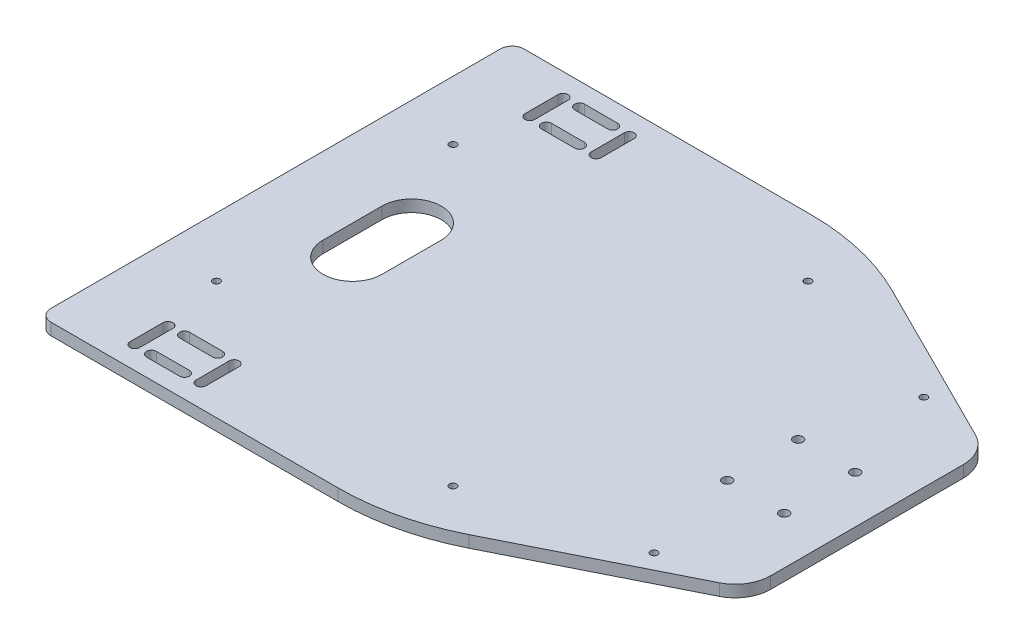
from build123d import *

# Parameters (mm, degrees)
BOSS_EXTRUDE2_DEPTH = 5
SKETCH7_R           = 1.5
CUT_EXTRUDE1_DEPTH  = 5
CUT_EXTRUDE2_DEPTH  = 5
SKETCH14_R          = 1.5
CUT_EXTRUDE3_DEPTH  = 161.15617378
SKETCH16_R          = 2
CUT_EXTRUDE4_DEPTH  = 161.15617378
CUT_EXTRUDE5_DEPTH  = 5


with BuildPart() as part:
    # Sketch1 → Boss-Extrude2 (new body)
    with BuildSketch(Plane(origin=(0, 0, 0), x_dir=(1, 0, 0), z_dir=(0, 1, 0))):
        with BuildLine():
            Line((-120, 100), (1.39320225, 100))
            ThreePointArc((1.39320225, 100), (24.368494305, 97.324898947), (46.1145618, 89.4427191))
            Line((46.1145618, 89.4427191), (116.708203932, 54.145898034))
            ThreePointArc((116.708203932, 54.145898034), (122.759762125, 48.615456851), (125, 40.729490169))
            Line((125, 40.729490169), (125, -40.729490169))
            ThreePointArc((125, -40.729490169), (122.759762125, -48.615456851), (116.708203932, -54.145898034))
            Line((116.708203932, -54.145898034), (46.1145618, -89.4427191))
            ThreePointArc((46.1145618, -89.4427191), (24.368494305, -97.324898947), (1.39320225, -100))
            Line((1.39320225, -100), (-120, -100))
            ThreePointArc((-120, -100), (-123.535533906, -98.535533906), (-125, -95))
            Line((-125, -95), (-125, 95))
            ThreePointArc((-125, 95), (-123.535533906, 98.535533906), (-120, 100))
        make_face()
    extrude(amount=-BOSS_EXTRUDE2_DEPTH)

    # Sketch7 → Cut-Extrude1 (cut)
    with BuildSketch(Plane(origin=(0, 0, 0), x_dir=(1, 0, 0), z_dir=(0, 1, 0))):
        with Locations(Location((-100, 50.003580751, 0), (0, 0, 270))):
            Circle(SKETCH7_R)
        with Locations(Location((-100, -49.996419249, 0), (0, 0, 270))):
            Circle(SKETCH7_R)
        with Locations(Location((25, 75.003580751, 0), (0, 0, 270))):
            Circle(SKETCH7_R)
        with Locations(Location((25, -74.996419249, 0), (0, 0, 270))):
            Circle(SKETCH7_R)
    extrude(amount=-CUT_EXTRUDE1_DEPTH, mode=Mode.SUBTRACT)

    # Sketch8 → Cut-Extrude2 (cut)
    with BuildSketch(Plane(origin=(0, 0, 0), x_dir=(1, 0, 0), z_dir=(0, 1, 0))):
        with BuildLine():
            Line((-96.1, 90.5), (-96.1, 76.5))
            ThreePointArc((-96.1, 76.5), (-94, 74.4), (-91.9, 76.5))
            Line((-91.9, 76.5), (-91.9, 90.5))
            ThreePointArc((-91.9, 90.5), (-94, 92.6), (-96.1, 90.5))
        make_face()
        with BuildLine():
            Line((-68.1, 90.5), (-68.1, 76.5))
            ThreePointArc((-68.1, 76.5), (-66, 74.4), (-63.9, 76.5))
            Line((-63.9, 76.5), (-63.9, 90.5))
            ThreePointArc((-63.9, 90.5), (-66, 92.6), (-68.1, 90.5))
        make_face()
        with BuildLine():
            Line((-87.000000572, 88.4), (-73, 88.4))
            ThreePointArc((-73, 88.4), (-70.9, 90.5), (-73, 92.6))
            Line((-73, 92.6), (-87, 92.6))
            ThreePointArc((-87, 92.6), (-89.100000572, 90.500000286), (-87.000000572, 88.4))
        make_face()
        with BuildLine():
            Line((-87, 74.4), (-73, 74.4))
            ThreePointArc((-73, 74.4), (-70.9, 76.5), (-73, 78.6))
            Line((-73, 78.6), (-87, 78.6))
            ThreePointArc((-87, 78.6), (-89.1, 76.5), (-87, 74.4))
        make_face()
        with BuildLine():
            Line((-87, -78.6), (-73, -78.6))
            ThreePointArc((-73, -78.6), (-70.9, -76.5), (-73, -74.4))
            Line((-73, -74.4), (-87, -74.4))
            ThreePointArc((-87, -74.4), (-89.1, -76.5), (-87, -78.6))
        make_face()
        with BuildLine():
            Line((-87, -92.6), (-73, -92.6))
            ThreePointArc((-73, -92.6), (-70.9, -90.5), (-73, -88.4))
            Line((-73, -88.4), (-87.000000572, -88.4))
            ThreePointArc((-87.000000572, -88.4), (-89.100000572, -90.500000286), (-87, -92.6))
        make_face()
        with BuildLine():
            Line((-63.9, -90.5), (-63.9, -76.5))
            ThreePointArc((-63.9, -76.5), (-66, -74.4), (-68.1, -76.5))
            Line((-68.1, -76.5), (-68.1, -90.5))
            ThreePointArc((-68.1, -90.5), (-66, -92.6), (-63.9, -90.5))
        make_face()
        with BuildLine():
            Line((-91.9, -90.5), (-91.9, -76.5))
            ThreePointArc((-91.9, -76.5), (-94, -74.4), (-96.1, -76.5))
            Line((-96.1, -76.5), (-96.1, -90.5))
            ThreePointArc((-96.1, -90.5), (-94, -92.6), (-91.9, -90.5))
        make_face()
    extrude(amount=-CUT_EXTRUDE2_DEPTH, mode=Mode.SUBTRACT)

    # Sketch14 → Cut-Extrude3 (cut, through all)
    with BuildSketch(Plane(origin=(0, 0, 0), x_dir=(1, 0, 0), z_dir=(0, 1, 0))):
        with Locations(Location((92, -56.993839984, 0), (0, 0, 270))):
            Circle(SKETCH14_R)
        with Locations(Location((92, 56.999582207, 0), (0, 0, 270))):
            Circle(SKETCH14_R)
    extrude(amount=-CUT_EXTRUDE3_DEPTH, mode=Mode.SUBTRACT)

    # Sketch16 → Cut-Extrude4 (cut, through all)
    with BuildSketch(Plane(origin=(0, 0, 0), x_dir=(1, 0, 0), z_dir=(0, 1, 0))):
        with Locations(Location((80.9, 15, 0), (0, 0, 270))):
            Circle(SKETCH16_R)
        with Locations(Location((105, 15, 0), (0, 0, 270))):
            Circle(SKETCH16_R)
        with Locations(Location((105, -15, 0), (0, 0, 90))):
            Circle(SKETCH16_R)
        with Locations(Location((80.9, -15, 0), (0, 0, 90))):
            Circle(SKETCH16_R)
    extrude(amount=-CUT_EXTRUDE4_DEPTH, mode=Mode.SUBTRACT)

    # Sketch17 → Cut-Extrude5 (cut)
    with BuildSketch(Plane(origin=(0, 0, 0), x_dir=(1, 0, 0), z_dir=(0, 1, 0))):
        with BuildLine():
            Line((-67.5, 12.5), (-67.5, -12.5))
            ThreePointArc((-67.5, -12.5), (-80, -25), (-92.5, -12.5))
            Line((-92.5, -12.5), (-92.5, 12.5))
            ThreePointArc((-92.5, 12.5), (-80, 25), (-67.5, 12.5))
        make_face()
    extrude(amount=-CUT_EXTRUDE5_DEPTH, mode=Mode.SUBTRACT)


solid = part.part
